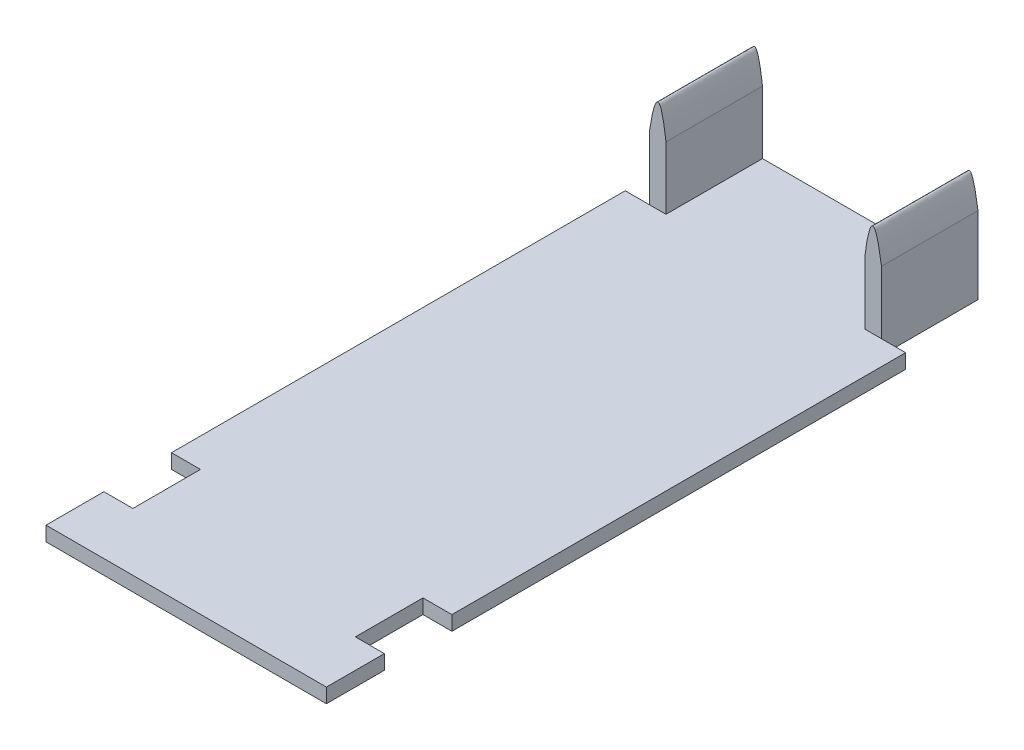
from build123d import *

# Parameters (mm, degrees)
BOSS_EXTRUDE1_DEPTH = 20
SKETCH2_W           = 5
SKETCH2_H           = 3
BOSS_EXTRUDE2_DEPTH = 120
SKETCH4_W           = 6
SKETCH4_H           = 14
CUT_EXTRUDE1_DEPTH  = 10


with BuildPart() as part:
    # Sketch1 → Boss-Extrude1 (new body)
    with BuildSketch(Plane.XY):
        with BuildLine():
            Line((-24.05, 64.8), (-24.05, 48.8))
            Line((-24.05, 48.8), (24.05, 48.8))
            Line((24.05, 48.8), (24.05, 64.8))
            add(Edge.make_bspline(
                [(24.05, 64.8), (22.187774265, 77.400108054), (20.594686421, 64.8)],
                knots=[0, 0, 0, 1, 1, 1], degree=2))
            Line((20.594686421, 64.8), (20.594686421, 51.8))
            Line((20.594686421, 51.8), (-20.594686421, 51.8))
            Line((-20.594686421, 51.8), (-20.594686421, 64.8))
            add(Edge.make_bspline(
                [(-24.05, 64.8), (-22.187774265, 77.400108054), (-20.594686421, 64.8)],
                knots=[0, 0, 0, 1, 1, 1], degree=2))
        make_face()
    extrude(amount=BOSS_EXTRUDE1_DEPTH)

    # Sketch2 → Boss-Extrude2 (add)
    with BuildSketch(Plane.XY.offset(20)):
        with Locations((-26.55, 50.3)):
            Rectangle(SKETCH2_W, SKETCH2_H)
        Polygon((-24.05, 51.8), (-24.05, 48.8), (24.05, 48.8), (24.05, 51.8), (20.594686421, 51.8), (-20.594686421, 51.8), align=None)
        with Locations((26.55, 50.3)):
            Rectangle(SKETCH2_W, SKETCH2_H)
    extrude(amount=BOSS_EXTRUDE2_DEPTH)

    # Sketch4 → Cut-Extrude1 (cut)
    with BuildSketch(Plane(origin=(0, 51.8, 0), x_dir=(1, 0, 0), z_dir=(0, 1, 0))):
        with Locations((-26.05, -121)):
            Rectangle(SKETCH4_W, SKETCH4_H)
        with Locations((26.05, -121)):
            Rectangle(SKETCH4_W, SKETCH4_H)
    extrude(amount=-CUT_EXTRUDE1_DEPTH, mode=Mode.SUBTRACT)


solid = part.part
